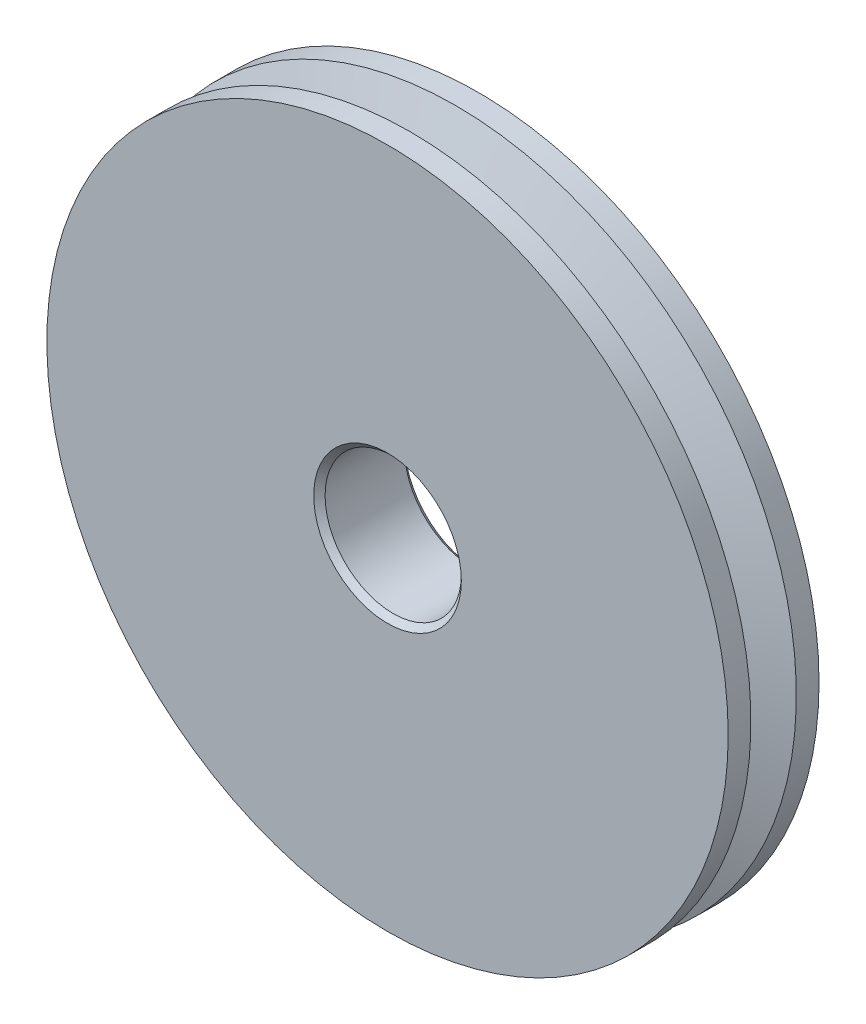
from build123d import *

# Parameters (mm, degrees)
SKETCH1_R      = 47.625
SKETCH1_R_2    = 9.525
EXTRUDE1_DEPTH = 6.35
CHAMFER1_SIZE  = 0.79375


with BuildPart() as part:
    # Sketch1 → Extrude1 (new, symmetric)
    with BuildSketch(Plane.XY):
        Circle(SKETCH1_R)
        Circle(SKETCH1_R_2, mode=Mode.SUBTRACT)
    extrude(amount=EXTRUDE1_DEPTH, both=True)

    # Chamfer1
    chamfer1_edges = [part.edges().sort_by_distance(p)[0] for p in [
        (-9.525, 0, -6.35),
        (-9.525, 0, 6.35),
    ]]
    chamfer(chamfer1_edges, length=CHAMFER1_SIZE)

    # Sketch2 → Cut-Revolve1 (revolve, cut)
    with BuildSketch(Plane(origin=(0, 0, 0), x_dir=(0, 0, -1), z_dir=(1, 0, 0)), mode=Mode.PRIVATE) as cut_revolve1_sk:
        Polygon((-3.175, 47.625), (3.175, 47.625), (0.863789012, 41.275), (-0.863789012, 41.275), align=None)
    revolve(cut_revolve1_sk.sketch.rotate(Axis((0, 0, 6.35), (0, 0, -1)), 180), axis=Axis((0, 0, 6.35), (0, 0, -1)), mode=Mode.SUBTRACT)


solid = part.part
